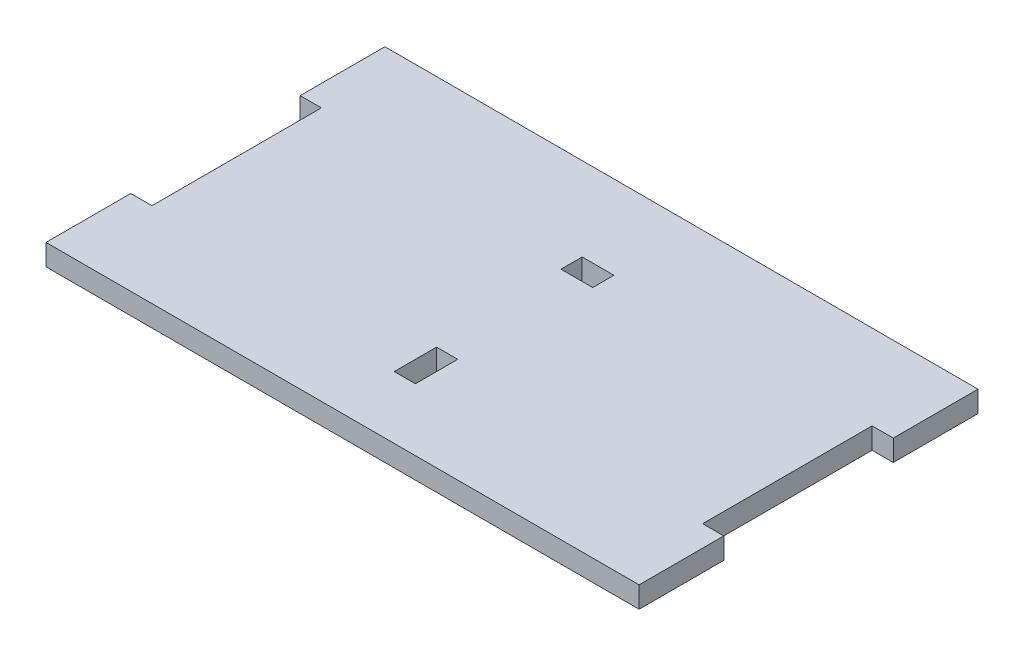
from build123d import *

# Parameters (mm, degrees)
SKETCH1_W           = 4.7625
SKETCH1_H           = 3.175
SKETCH1_W_2         = 3.175
SKETCH1_H_2         = 6.35
BOSS_EXTRUDE1_DEPTH = 3.175


with BuildPart() as part:
    # Sketch1 → Boss-Extrude1 (new body)
    with BuildSketch(Plane(origin=(0, 0, 0), x_dir=(1, 0, 0), z_dir=(0, 1, 0))):
        Polygon((-41.275, -12.7), (-41.275, 12.7), (-44.45, 12.7), (-44.45, 25.4), (-41.275, 25.4), (41.275, 25.4), (44.45, 25.4), (44.45, 12.7), (41.275, 12.7), (41.275, -12.7), (44.45, -12.7), (44.45, -25.4), (41.275, -25.4), (-41.275, -25.4), (-44.45, -25.4), (-44.45, -12.7), align=None)
        with Locations((0, 11.303)):
            Rectangle(SKETCH1_W, SKETCH1_H, mode=Mode.SUBTRACT)
        with Locations((0, -12.8905)):
            Rectangle(SKETCH1_W_2, SKETCH1_H_2, mode=Mode.SUBTRACT)
    extrude(amount=BOSS_EXTRUDE1_DEPTH)


solid = part.part
